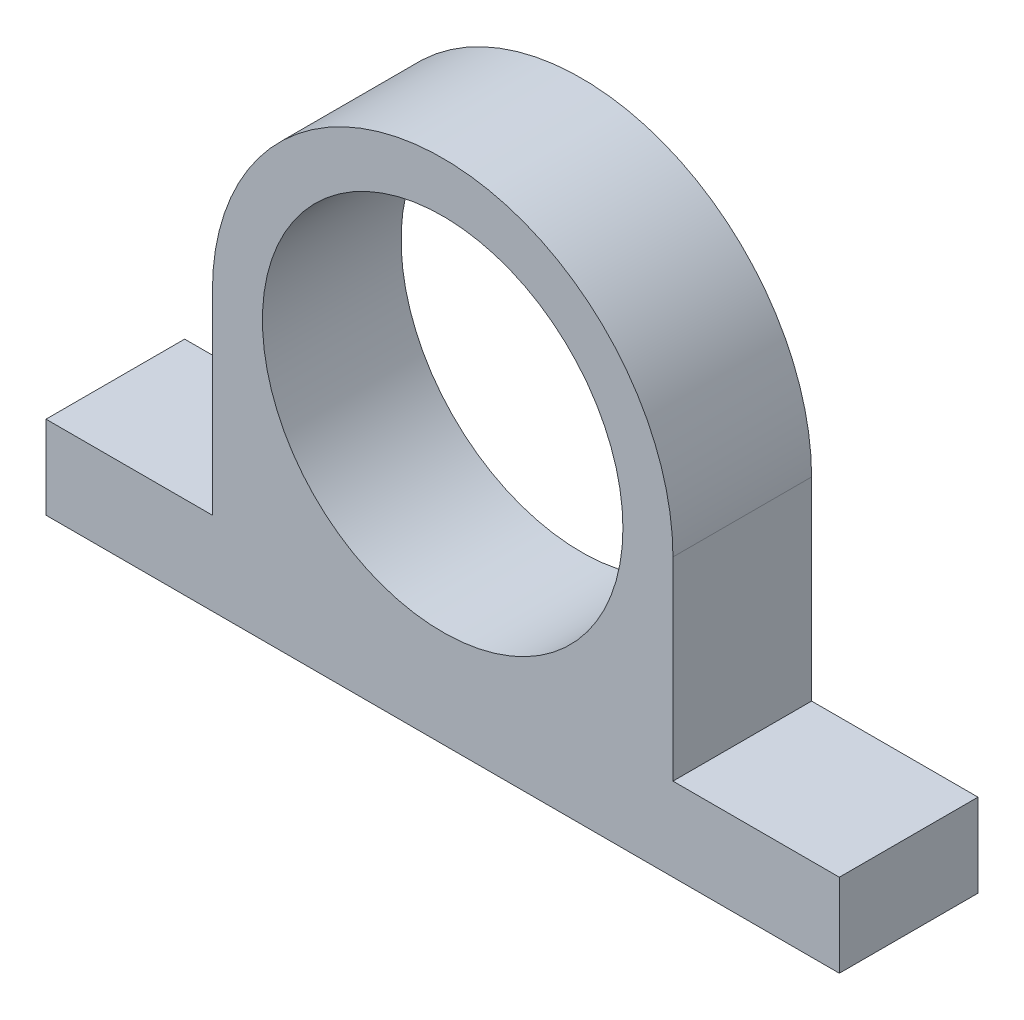
from build123d import *

# Parameters (mm, degrees)
SKETCH1_R           = 65
BOSS_EXTRUDE3_DEPTH = 50


with BuildPart() as part:
    # Sketch1 → Boss-Extrude3 (new body)
    with BuildSketch(Plane.XY):
        with BuildLine():
            Line((-119.388753371, -28.048506758), (-119.388753371, -98.048506758))
            Line((-119.388753371, -98.048506758), (-179.388753371, -98.048506758))
            Line((-179.388753371, -98.048506758), (-179.388753371, -128.048506758))
            Line((-179.388753371, -128.048506758), (106.690175812, -128.048506758))
            Line((106.690175812, -128.048506758), (106.690175812, -98.048506758))
            Line((106.690175812, -98.048506758), (46.690175812, -98.048506758))
            Line((46.690175812, -98.048506758), (46.690175812, -28.048506758))
            ThreePointArc((46.690175812, -28.048506758), (-36.34928878, 54.990957833), (-119.388753371, -28.048506758))
        make_face()
        with Locations((-36.34928878, -28.048506758)):
            Circle(SKETCH1_R, mode=Mode.SUBTRACT)
    extrude(amount=BOSS_EXTRUDE3_DEPTH)


solid = part.part
